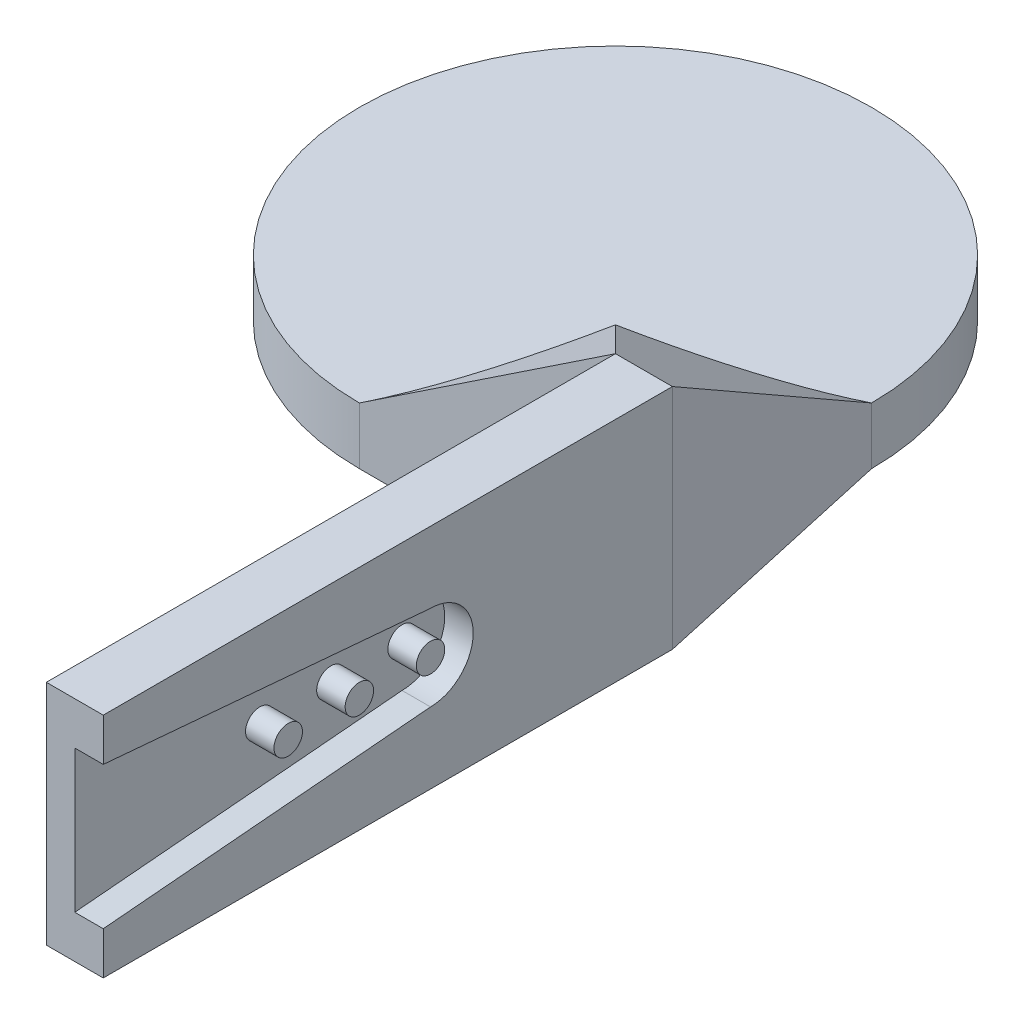
from build123d import *

# Parameters (mm, degrees)
SKETCH1_R           = 9
BOSS_EXTRUDE1_DEPTH = 2
BOSS_EXTRUDE2_DEPTH = 8
SKETCH1_5_R         = 0.5
CUT_EXTRUDE1_DEPTH  = 1
CUT_EXTRUDE2_DEPTH  = 9
CUT_EXTRUDE3_DEPTH  = 9.985985619
SKETCH4_R           = 0.5
CUT_EXTRUDE5_DEPTH  = 1


with BuildPart() as part:
    # Sketch1 → Boss-Extrude1 (new body)
    with BuildSketch(Plane(origin=(0, 0, 0), x_dir=(1, 0, 0), z_dir=(0, 1, 0))):
        Circle(SKETCH1_R)
    extrude(amount=BOSS_EXTRUDE1_DEPTH)

    # Sketch1<4> → Boss-Extrude2 (add)
    with BuildSketch(Plane(origin=(0, 0, 0), x_dir=(1, 0, 0), z_dir=(0, 1, 0))):
        with BuildLine():
            ThreePointArc((9, 0), (6.363961031, -6.363961031), (0, -9))
            Line((0, -9), (9, -9))
            Line((9, -9), (9, -29))
            Line((9, -29), (11, -29))
            Line((11, -29), (11, -9))
            Line((11, -9), (9, 0))
        make_face()
    extrude(amount=BOSS_EXTRUDE2_DEPTH)

    # Sketch1<5> → Cut-Extrude1 (cut)
    with BuildSketch(Plane(origin=(0, 0, 0), x_dir=(1, 0, 0), z_dir=(0, 1, 0))):
        with BuildLine():
            ThreePointArc((1.5, -2), (1.767766953, -1.767766953), (2, -1.5))
            Line((2, -1.5), (6.5, -1.5))
            ThreePointArc((6.5, -1.5), (8, 0), (6.5, 1.5))
            Line((6.5, 1.5), (2, 1.5))
            ThreePointArc((2, 1.5), (1.767766953, 1.767766953), (1.5, 2))
            Line((1.5, 2), (1.5, 6.5))
            ThreePointArc((1.5, 6.5), (0, 8), (-1.5, 6.5))
            Line((-1.5, 6.5), (-1.5, 2))
            ThreePointArc((-1.5, 2), (-1.767766953, 1.767766953), (-2, 1.5))
            Line((-2, 1.5), (-6.5, 1.5))
            ThreePointArc((-6.5, 1.5), (-8, 0), (-6.5, -1.5))
            Line((-6.5, -1.5), (-2, -1.5))
            ThreePointArc((-2, -1.5), (-1.767766953, -1.767766953), (-1.5, -2))
            Line((-1.5, -2), (-1.5, -6.5))
            ThreePointArc((-1.5, -6.5), (0, -8), (1.5, -6.5))
            Line((1.5, -6.5), (1.5, -2))
        make_face()
        with Locations((6.5, 0)):
            Circle(SKETCH1_5_R, mode=Mode.SUBTRACT)
        with Locations((0, -6.5)):
            Circle(SKETCH1_5_R, mode=Mode.SUBTRACT)
        with Locations((-6.5, 0)):
            Circle(SKETCH1_5_R, mode=Mode.SUBTRACT)
        with Locations((0, 6.5)):
            Circle(SKETCH1_5_R, mode=Mode.SUBTRACT)
    extrude(amount=CUT_EXTRUDE1_DEPTH, mode=Mode.SUBTRACT)

    # Sketch2 → Cut-Extrude2 (cut)
    with BuildSketch(Plane.XY.offset(9)):
        Polygon((0, 2), (9, 8), (0, 8), align=None)
    extrude(amount=-CUT_EXTRUDE2_DEPTH, mode=Mode.SUBTRACT)

    # Sketch3 → Cut-Extrude3 (cut)
    with BuildSketch(Plane(origin=(11, 0, 0), x_dir=(0, 0, -1), z_dir=(1, 0, 0))):
        Polygon((-9, 8), (0, 2), (0, 8), align=None)
    extrude(amount=-CUT_EXTRUDE3_DEPTH, mode=Mode.SUBTRACT)

    # Sketch4 → Cut-Extrude5 (cut)
    with BuildSketch(Plane(origin=(11, 0, 0), x_dir=(0, 0, -1), z_dir=(1, 0, 0))):
        with BuildLine():
            Line((-29, 6.5), (-29, 1.5))
            Line((-29, 1.5), (-17.5, 2.5))
            ThreePointArc((-17.5, 2.5), (-16, 4), (-17.5, 5.5))
            Line((-17.5, 5.5), (-29, 6.5))
        make_face()
        with Locations((-22.5, 4)):
            Circle(SKETCH4_R, mode=Mode.SUBTRACT)
        with Locations((-20, 4)):
            Circle(SKETCH4_R, mode=Mode.SUBTRACT)
        with Locations((-17.5, 4)):
            Circle(SKETCH4_R, mode=Mode.SUBTRACT)
    extrude(amount=-CUT_EXTRUDE5_DEPTH, mode=Mode.SUBTRACT)


solid = part.part
